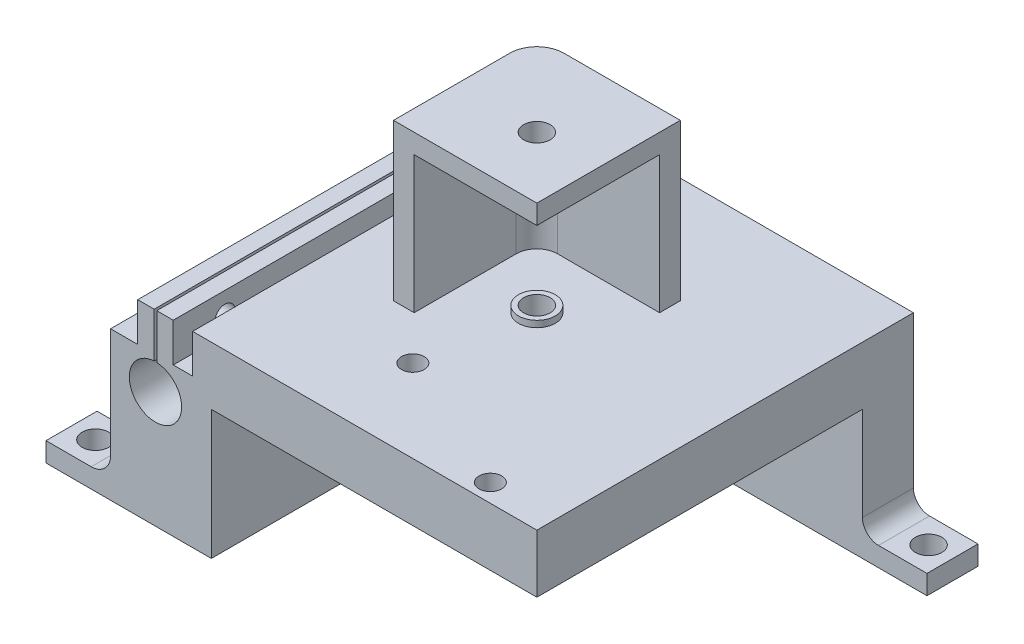
from build123d import *

# Parameters (mm, degrees)
SKETCH1_W           = 66
SKETCH1_H           = 58.3
SKETCH1_R           = 2.05
BOSS_EXTRUDE1_DEPTH = 29
CUT_EXTRUDE1_START  = -29
CUT_EXTRUDE1_DEPTH  = 20
SKETCH6_W           = 10
SKETCH6_H           = 7.9
SKETCH6_R           = 2.05
BOSS_EXTRUDE2_DEPTH = 3
BOSS_EXTRUDE4_DEPTH = 7.9
BOSS_EXTRUDE5_START = -50.4
BOSS_EXTRUDE5_DEPTH = 7.9
CUT_EXTRUDE4_START  = -58.3
SKETCH8_R           = 4.05
CUT_EXTRUDE4_DEPTH  = 58.3
CUT_EXTRUDE5_REACH  = 80.031
SKETCH10_W          = 3
SKETCH10_H          = 6
SKETCH10_W_2        = 4.2
SKETCH10_W_3        = 0.4
SKETCH10_H_2        = 7.617508416
CUT_EXTRUDE6_REACH  = 84.74
SKETCH11_R          = 1.55
CUT_EXTRUDE7_DEPTH  = 2.5
BOSS_EXTRUDE6_DEPTH = 21.2
SKETCH14_R          = 2.05
BOSS_EXTRUDE7_DEPTH = 3
BOSS_EXTRUDE8_START = -4
SKETCH15_R          = 2.85
SKETCH15_R_2        = 2.05
BOSS_EXTRUDE8_DEPTH = 1
BOSS_EXTRUDE9_START = -24.2
SKETCH15_2_R        = 2.85
SKETCH15_2_R_2      = 2.05
BOSS_EXTRUDE9_DEPTH = 1
SKETCH16_W          = 60.451877866
SKETCH16_H          = 7.9
CUT_EXTRUDE8_DEPTH  = 20
SKETCH19_R          = 1.75
CUT_EXTRUDE9_DEPTH  = 9


with BuildPart() as part:
    # Sketch1 → Boss-Extrude1 (new body)
    with BuildSketch(Plane(origin=(0, 0, 0), x_dir=(1, 0, 0), z_dir=(0, 1, 0))):
        Rectangle(SKETCH1_W, SKETCH1_H)
        with Locations(Location((-3.85, 0, 0), (0, 0, 90))):
            Circle(SKETCH1_R, mode=Mode.SUBTRACT)
    extrude(amount=BOSS_EXTRUDE1_DEPTH)

    # Sketch3 → Cut-Extrude1 (cut)
    with BuildSketch(Plane(origin=(0, 29, 0), x_dir=(1, 0, 0), z_dir=(0, 1, 0)).offset(CUT_EXTRUDE1_START)):
        Polygon((-33, 21.25), (-33, -21.25), (17.4, -21.25), (17.4, 21.25), (-25.1, 21.25), align=None)
    extrude(amount=CUT_EXTRUDE1_DEPTH, mode=Mode.SUBTRACT)

    # Sketch6 → Boss-Extrude2 (add)
    # profile 1 of 4: a face of its own
    with BuildSketch(Plane.XZ):
        with Locations((-38, 25.2)):
            Rectangle(SKETCH6_W, SKETCH6_H)
        with Locations(Location((-39.3, 25.2, 0), (0, 0, 270))):
            Circle(SKETCH6_R, mode=Mode.SUBTRACT)
    # profile 2 of 4: a face of its own
    with BuildSketch(Plane.XZ):
        with Locations((-38, -25.2)):
            Rectangle(SKETCH6_W, SKETCH6_H)
        with Locations(Location((-39.3, -25.2, 0), (0, 0, 270))):
            Circle(SKETCH6_R, mode=Mode.SUBTRACT)
    # profile 3 of 4: a face of its own
    with BuildSketch(Plane.XZ):
        with Locations((38, 25.2)):
            Rectangle(SKETCH6_W, SKETCH6_H)
        with Locations(Location((39.3, 25.2, 0), (0, 0, 270))):
            Circle(SKETCH6_R, mode=Mode.SUBTRACT)
    # profile 4 of 4: a face of its own
    with BuildSketch(Plane.XZ):
        with Locations((38, -25.2)):
            Rectangle(SKETCH6_W, SKETCH6_H)
        with Locations(Location((39.3, -25.2, 0), (0, 0, 270))):
            Circle(SKETCH6_R, mode=Mode.SUBTRACT)
    extrude(amount=-BOSS_EXTRUDE2_DEPTH)

    # Sketch7 → Boss-Extrude4 (add)
    with BuildSketch(Plane(origin=(0, 0, -29.15), x_dir=(-1, 0, 0), z_dir=(0, 0, -1))):
        with BuildLine():
            ThreePointArc((35.5, 3), (33.732233047, 3.732233047), (33, 5.5))
            Line((33, 5.5), (33, 3))
            Line((33, 3), (35.5, 3))
        make_face()
        with BuildLine():
            ThreePointArc((-33, 6), (-33.878679656, 3.878679656), (-36, 3))
            Line((-36, 3), (-33, 3))
            Line((-33, 3), (-33, 6))
        make_face()
    extrude(amount=-BOSS_EXTRUDE4_DEPTH)

    # Sketch7<5> → Boss-Extrude5 (add)
    with BuildSketch(Plane(origin=(0, 0, -29.15), x_dir=(-1, 0, 0), z_dir=(0, 0, -1)).offset(BOSS_EXTRUDE5_START)):
        with BuildLine():
            ThreePointArc((35.5, 3), (33.732233047, 3.732233047), (33, 5.5))
            Line((33, 5.5), (33, 3))
            Line((33, 3), (35.5, 3))
        make_face()
        with BuildLine():
            ThreePointArc((-33, 6), (-33.878679656, 3.878679656), (-36, 3))
            Line((-36, 3), (-33, 3))
            Line((-33, 3), (-33, 6))
        make_face()
    extrude(amount=-BOSS_EXTRUDE5_DEPTH)

    # Sketch8 → Cut-Extrude4 (cut)
    with BuildSketch(Plane.XY.offset(29.15).offset(CUT_EXTRUDE4_START)):
        with Locations(Location((26.05, 18, 0), (0, 0, 180))):
            Circle(SKETCH8_R)
    extrude(amount=CUT_EXTRUDE4_DEPTH, mode=Mode.SUBTRACT)

    # Sketch10 → Cut-Extrude5 (cut, up to next)
    with BuildSketch(Plane(origin=(0, 0, -29.15), x_dir=(-1, 0, 0), z_dir=(0, 0, -1)), mode=Mode.PRIVATE) as cut_extrude5_sk1:
        with Locations((-21.8, 26)):
            Rectangle(SKETCH10_W, SKETCH10_H)
    cut_extrude5_tool1 = extrude(cut_extrude5_sk1.sketch, amount=-CUT_EXTRUDE5_REACH, mode=Mode.PRIVATE) & part.part
    # Sketch10 → Cut-Extrude5 (cut, up to next)
    with BuildSketch(Plane(origin=(0, 0, -29.15), x_dir=(-1, 0, 0), z_dir=(0, 0, -1)), mode=Mode.PRIVATE) as cut_extrude5_sk2:
        with Locations((-30.9, 26)):
            Rectangle(SKETCH10_W_2, SKETCH10_H)
    cut_extrude5_tool2 = extrude(cut_extrude5_sk2.sketch, amount=-CUT_EXTRUDE5_REACH, mode=Mode.PRIVATE) & part.part
    # Sketch10 → Cut-Extrude5 (cut, up to next)
    with BuildSketch(Plane(origin=(0, 0, -29.15), x_dir=(-1, 0, 0), z_dir=(0, 0, -1)), mode=Mode.PRIVATE) as cut_extrude5_sk3:
        with Locations((-26.05, 25.191245792)):
            Rectangle(SKETCH10_W_3, SKETCH10_H_2)
    cut_extrude5_tool3 = extrude(cut_extrude5_sk3.sketch, amount=-CUT_EXTRUDE5_REACH, mode=Mode.PRIVATE) & part.part
    add(cut_extrude5_tool1.solids().sort_by_distance((21.8, 26, -29.15))[0], mode=Mode.SUBTRACT)
    add(cut_extrude5_tool2.solids().sort_by_distance((30.9, 26, -29.15))[0], mode=Mode.SUBTRACT)
    add(cut_extrude5_tool3.solids().sort_by_distance((26.05, 25.191246, -29.15))[0], mode=Mode.SUBTRACT)

    # Cut-Extrude6: up to this face of the body (flat: up to its plane)
    cut_extrude6_end = Plane(part.part.faces().sort_by_distance((23.3, 26, 0))[0])
    # Sketch11 → Cut-Extrude6 (cut, up to the picked face)
    with BuildSketch(Plane(origin=(28.8, 0, 0), x_dir=(0, 0, -1), z_dir=(1, 0, 0)), mode=Mode.PRIVATE) as cut_extrude6_sk1:
        with Locations((-21.15, 25.6)):
            Circle(SKETCH11_R)
    cut_extrude6_tool1 = split(extrude(cut_extrude6_sk1.sketch, amount=-CUT_EXTRUDE6_REACH, mode=Mode.PRIVATE), bisect_by=cut_extrude6_end, keep=Keep.BOTH, mode=Mode.PRIVATE)
    # Sketch11 → Cut-Extrude6 (cut, up to the picked face)
    with BuildSketch(Plane(origin=(28.8, 0, 0), x_dir=(0, 0, -1), z_dir=(1, 0, 0)), mode=Mode.PRIVATE) as cut_extrude6_sk2:
        with Locations((21.15, 25.6)):
            Circle(SKETCH11_R)
    cut_extrude6_tool2 = split(extrude(cut_extrude6_sk2.sketch, amount=-CUT_EXTRUDE6_REACH, mode=Mode.PRIVATE), bisect_by=cut_extrude6_end, keep=Keep.BOTH, mode=Mode.PRIVATE)
    add(cut_extrude6_tool1.solids().sort_by(Axis((28.8, 25.6, 21.15), (-1, 0, 0)))[0], mode=Mode.SUBTRACT)
    add(cut_extrude6_tool2.solids().sort_by(Axis((28.8, 25.6, -21.15), (-1, 0, 0)))[0], mode=Mode.SUBTRACT)

    # Sketch12 → Cut-Extrude7 (cut)
    with BuildSketch(Plane.XZ.offset(-20)):
        Polygon((-7.95, 0), (-5.9, -3.550704156), (-1.8, -3.550704156), (0.25, 0), (-1.8, 3.550704156), (-5.9, 3.550704156), align=None)
    extrude(amount=-CUT_EXTRUDE7_DEPTH, mode=Mode.SUBTRACT)

    # Sketch13 → Boss-Extrude6 (add)
    with BuildSketch(Plane(origin=(0, 29, 0), x_dir=(1, 0, 0), z_dir=(0, 1, 0))):
        with BuildLine():
            Line((-13.35, 9.5), (-13.35, 12.7))
            Line((-13.35, 12.7), (4.65, 12.7))
            ThreePointArc((4.65, 12.7), (7.619848481, 11.469848481), (8.85, 8.5))
            Line((8.85, 8.5), (8.85, -9.5))
            Line((8.85, -9.5), (5.65, -9.5))
            Line((5.65, -9.5), (5.65, 6.3))
            ThreePointArc((5.65, 6.3), (4.7127417, 8.5627417), (2.45, 9.5))
            Line((2.45, 9.5), (-13.35, 9.5))
        make_face()
    extrude(amount=BOSS_EXTRUDE6_DEPTH)

    # Sketch14 → Boss-Extrude7 (add)
    with BuildSketch(Plane(origin=(0, 50.2, 0), x_dir=(1, 0, 0), z_dir=(0, 1, 0))):
        with BuildLine():
            Line((-13.35, 12.7), (4.65, 12.7))
            ThreePointArc((4.65, 12.7), (7.619848481, 11.469848481), (8.85, 8.5))
            Line((8.85, 8.5), (8.85, -9.5))
            Line((8.85, -9.5), (-13.35, -9.5))
            Line((-13.35, -9.5), (-13.35, 12.7))
        make_face()
        with Locations(Location((-3.85, 0, 0), (0, 0, 90))):
            Circle(SKETCH14_R, mode=Mode.SUBTRACT)
    extrude(amount=BOSS_EXTRUDE7_DEPTH)

    # Sketch15 → Boss-Extrude8 (add)
    with BuildSketch(Plane(origin=(0, 53.2, 0), x_dir=(1, 0, 0), z_dir=(0, 1, 0)).offset(BOSS_EXTRUDE8_START)):
        with Locations(Location((-3.85, 0, 0), (0, 0, 270))):
            Circle(SKETCH15_R)
        with Locations(Location((-3.85, 0, 0), (0, 0, 90))):
            Circle(SKETCH15_R_2, mode=Mode.SUBTRACT)
    extrude(amount=BOSS_EXTRUDE8_DEPTH)

    # Sketch15<2> → Boss-Extrude9 (add)
    with BuildSketch(Plane(origin=(0, 53.2, 0), x_dir=(1, 0, 0), z_dir=(0, 1, 0)).offset(BOSS_EXTRUDE9_START)):
        with Locations(Location((-3.85, 0, 0), (0, 0, 270))):
            Circle(SKETCH15_2_R)
        with Locations(Location((-3.85, 0, 0), (0, 0, 90))):
            Circle(SKETCH15_2_R_2, mode=Mode.SUBTRACT)
    extrude(amount=BOSS_EXTRUDE9_DEPTH)


with BuildPart() as body_2:
    # Mirror2: mirrored copy
    add(part.part.mirror(Plane(origin=(-43, 3, -21.25), x_dir=(0, 0, 1), z_dir=(-1, 0, 0))))

    # Sketch16 → Cut-Extrude8 (cut)
    with BuildSketch(Plane.XZ):
        with Locations((-73.174061067, 25.2)):
            Rectangle(SKETCH16_W, SKETCH16_H)
    extrude(amount=-CUT_EXTRUDE8_DEPTH, mode=Mode.SUBTRACT)

    # Sketch19 → Cut-Extrude9 (cut)
    with BuildSketch(Plane.XZ.offset(-20)):
        with Locations(Location((-85, 16.35, 0), (0, 0, 270))):
            Circle(SKETCH19_R)
        with Locations(Location((-63, 26.35, 0), (0, 0, 270))):
            Circle(SKETCH19_R)
    extrude(amount=-CUT_EXTRUDE9_DEPTH, mode=Mode.SUBTRACT)


solid = body_2.part
